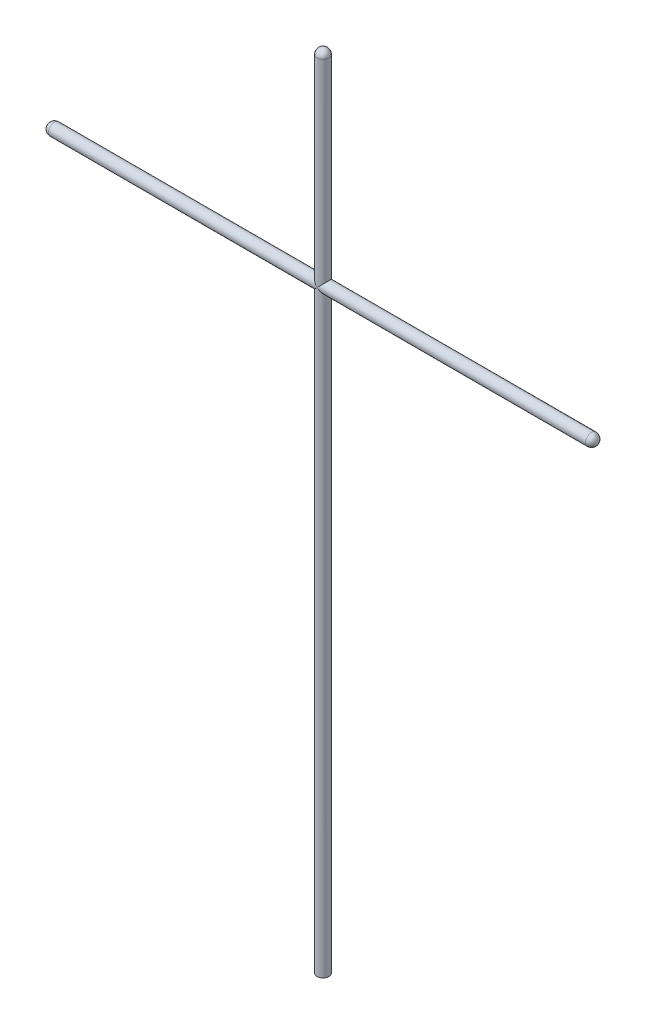
from build123d import *

# Parameters (mm, degrees)
SKETCH_1_R      = 6
EXTRUDE_1_DEPTH = 800
SKETCH_2_R      = 6
EXTRUDE_2_DEPTH = 270
REVOLVE_1_ANGLE = 180
REVOLVE_2_ANGLE = 180


with BuildPart() as part:
    # 草图1 → 凸台-拉伸1 (new body)
    with BuildSketch(Plane(origin=(0, 0, 0), x_dir=(1, 0, 0), z_dir=(0, 1, 0))):
        Circle(SKETCH_1_R)
    extrude(amount=EXTRUDE_1_DEPTH)

    # 草图2 → 凸台-拉伸2 (add, symmetric)
    with BuildSketch(Plane(origin=(0, 0, 0), x_dir=(0, 0, -1), z_dir=(1, 0, 0))):
        with Locations((0, 600)):
            Circle(SKETCH_2_R)
    extrude(amount=EXTRUDE_2_DEPTH, both=True)

    # 草图3 → 旋转1 (revolve)
    with BuildSketch(Plane(origin=(270, 0, 0), x_dir=(0, 0, -1), z_dir=(1, 0, 0))):
        with BuildLine():
            Line((0, 606), (0, 594))
            ThreePointArc((0, 594), (6, 600), (0, 606))
        make_face()
    revolve_1 = revolve(axis=Axis((270, 606, 0), (0, -1, 0)), revolution_arc=REVOLVE_1_ANGLE)

    # 草图4 → 旋转2 (revolve)
    with BuildSketch(Plane(origin=(0, 800, 0), x_dir=(1, 0, 0), z_dir=(0, 1, 0))):
        with BuildLine():
            Line((0, 6), (0, -6))
            ThreePointArc((0, -6), (6, 0), (0, 6))
        make_face()
    revolve(axis=Axis((0, 800, -6), (0, 0, 1)), revolution_arc=REVOLVE_2_ANGLE)

    # 镜向1: 旋转1 across plane
    add(revolve_1.mirror(Plane(origin=(0, 0, 0), x_dir=(0, 0, 1), z_dir=(1, 0, 0))))


solid = part.part
